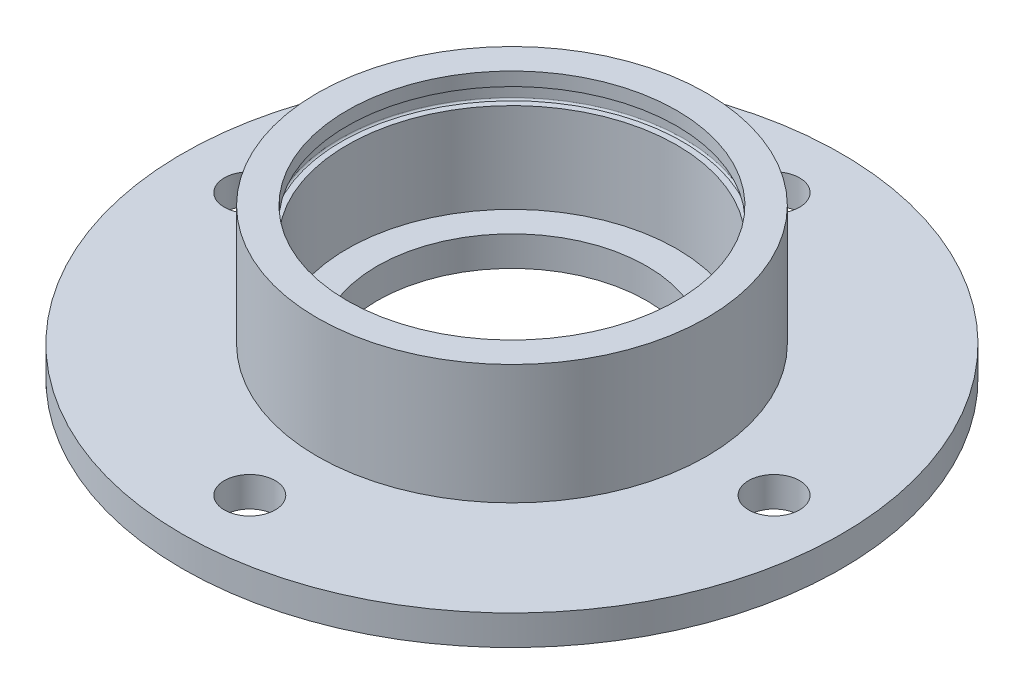
from build123d import *

# Parameters (mm, degrees)
M3_CLEARANCE_HOLE1_D = 3.4


with BuildPart() as part:
    # Sketch1 → Revolve1 (revolve)
    with BuildSketch(Plane.XY, mode=Mode.PRIVATE) as revolve1_sk:
        Polygon((9, 0), (11, 0), (11, 8), (13, 8), (13, 0), (22, 0), (22, -2), (9, -2), align=None)
    revolve(revolve1_sk.sketch.rotate(Axis((0, 17.954019247, 0), (0, -1, 0)), 90), axis=Axis((0, 17.954019247, 0), (0, -1, 0)))

    # Sketch4 → Groove for BS 3673 P4 - B022M, Internal Circlip1 (revolve, cut)
    with BuildSketch(Plane(origin=(0, 17.954019247, 0), x_dir=(0, 0, 1), z_dir=(-1, 0, 0))):
        with BuildLine():
            Line((11.39, -11.954019247), (9.9, -11.954019247))
            Line((9.9, -11.954019247), (9.9, -10.854019247))
            Line((9.9, -10.854019247), (11.39, -10.854019247))
            ThreePointArc((11.39, -10.854019247), (11.467781746, -10.886237501), (11.5, -10.964019247))
            Line((11.5, -10.964019247), (11.5, -11.844019247))
            ThreePointArc((11.5, -11.844019247), (11.467781746, -11.921800993), (11.39, -11.954019247))
        make_face()
    revolve(axis=Axis((0, -32.045980753, 0), (0, 1, 0)), mode=Mode.SUBTRACT)

    # M3 Clearance Hole1 (through all)
    with Locations(Plane(origin=(0, 0, 0), x_dir=(1, 0, 0), z_dir=(0, 1, 0))):
        with Locations((0, 17.5), (17.5, 0), (0, -17.5), (-17.5, 0)):
            Hole(M3_CLEARANCE_HOLE1_D / 2)


solid = part.part
